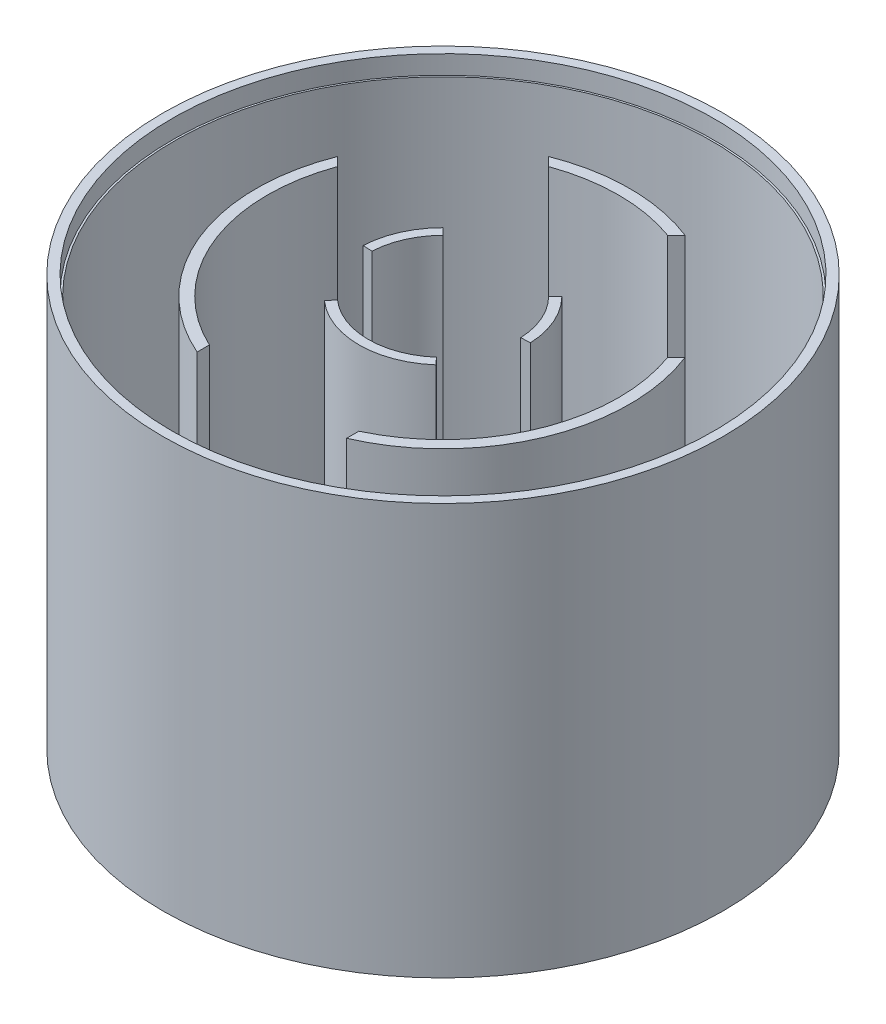
from build123d import *

# Parameters (mm, degrees)
SKETCH1_R           = 75
BOSS_EXTRUDE1_DEPTH = 110
SKETCH2_R           = 72
CUT_EXTRUDE1_DEPTH  = 100
SKETCH3_R           = 72.5
CUT_EXTRUDE2_DEPTH  = 5
SKETCH8_R           = 50
SKETCH8_R_2         = 47
BOSS_EXTRUDE4_DEPTH = 95
SKETCH10_R          = 22.5
SKETCH10_R_2        = 20
BOSS_EXTRUDE5_DEPTH = 95
CUT_EXTRUDE3_START  = -95
SKETCH11_W          = 20
SKETCH11_H          = 27.4
CUT_EXTRUDE3_DEPTH  = 95


with BuildPart() as part:
    # Sketch1 → Boss-Extrude1 (new body)
    with BuildSketch(Plane(origin=(0, 0, 0), x_dir=(1, 0, 0), z_dir=(0, 1, 0))):
        with Locations(Location((0, 0, 0), (0, 0, 90))):
            Circle(SKETCH1_R)
    extrude(amount=BOSS_EXTRUDE1_DEPTH)

    # Sketch2 → Cut-Extrude1 (cut)
    with BuildSketch(Plane(origin=(0, 110, 0), x_dir=(1, 0, 0), z_dir=(0, 1, 0))):
        with Locations(Location((0, 0, 0), (0, 0, 270))):
            Circle(SKETCH2_R)
    extrude(amount=-CUT_EXTRUDE1_DEPTH, mode=Mode.SUBTRACT)

    # Sketch3 → Cut-Extrude2 (cut)
    with BuildSketch(Plane(origin=(0, 110, 0), x_dir=(1, 0, 0), z_dir=(0, 1, 0))):
        with Locations(Location((0, 0, 0), (0, 0, 270))):
            Circle(SKETCH3_R)
    extrude(amount=-CUT_EXTRUDE2_DEPTH, mode=Mode.SUBTRACT)

    # Sketch8 → Boss-Extrude4 (add)
    with BuildSketch(Plane(origin=(0, 10, 0), x_dir=(1, 0, 0), z_dir=(0, 1, 0))):
        with Locations(Location((0, 0, 0), (0, 0, 270))):
            Circle(SKETCH8_R)
        with Locations(Location((0, 0, 0), (0, 0, 270))):
            Circle(SKETCH8_R_2, mode=Mode.SUBTRACT)
    extrude(amount=BOSS_EXTRUDE4_DEPTH)

    # Sketch10 → Boss-Extrude5 (add)
    with BuildSketch(Plane(origin=(0, 10, 0), x_dir=(1, 0, 0), z_dir=(0, 1, 0))):
        with Locations(Location((0, 0, 0), (0, 0, 270))):
            Circle(SKETCH10_R)
        with Locations(Location((0, 0, 0), (0, 0, 270))):
            Circle(SKETCH10_R_2, mode=Mode.SUBTRACT)
    extrude(amount=BOSS_EXTRUDE5_DEPTH)

    # Sketch11 → Cut-Extrude3 (cut)
    with BuildSketch(Plane(origin=(0, 105, 0), x_dir=(1, 0, 0), z_dir=(0, 1, 0)).offset(CUT_EXTRUDE3_START)):
        with Locations((-10, -36.3)):
            Rectangle(SKETCH11_W, SKETCH11_H)
        with Locations((10, -36.3)):
            Rectangle(SKETCH11_W, SKETCH11_H)
        Polygon((-35.352400393, 35.358277481), (-15.986116357, 15.988773936), (-15.984553545, 15.990430632), (-2.254814273, 30.544962608), (-21.21026477, 49.500413105), align=None)
        Polygon((-49.494536017, 21.216141857), (-29.714292817, 1.435898657), (-15.986116357, 15.988773936), (-35.352400393, 35.358277481), align=None)
        Polygon((2.486026551, 30.767534041), (15.99775062, 15.995091549), (35.358277481, 35.352400393), (21.217317324, 49.495711386), align=None)
        Polygon((35.358277481, 35.352400393), (15.99775062, 15.995091549), (29.509474689, 1.222649056), (49.499237638, 21.209089401), align=None)
        with BuildLine():
            ThreePointArc((-13.25433726, -14.977401103), (-18.428729118, -7.770581901), (-19.97668921, 0.96534356))
            Line((-19.97668921, 0.96534356), (-22.473775362, 1.086011505))
            ThreePointArc((-22.473775362, 1.086011505), (-20.732320258, -8.741904639), (-14.911129417, -16.849576241))
            Line((-14.911129417, -16.849576241), (-13.25433726, -14.977401103))
        make_face()
        with BuildLine():
            ThreePointArc((20, 0), (18.235771785, -8.213198366), (13.25433726, -14.977401103))
            Line((13.25433726, -14.977401103), (14.911129417, -16.849576241))
            ThreePointArc((14.911129417, -16.849576241), (20.515243258, -9.239848162), (22.5, 0))
            ThreePointArc((22.5, 0), (22.495177624, 0.46581504), (22.480712564, 0.931430406))
            Line((22.480712564, 0.931430406), (19.982855613, 0.827938139))
            ThreePointArc((19.982855613, 0.827938139), (19.995713444, 0.414057814), (20, 0))
        make_face()
        with BuildLine():
            Line((-15.908580177, 15.911224866), (-14.140960157, 14.143310992))
            ThreePointArc((-14.140960157, 14.143310992), (0.001662291, 19.999999931), (14.143310992, 14.140960157))
            Line((14.143310992, 14.140960157), (15.911224866, 15.908580177))
            ThreePointArc((15.911224866, 15.908580177), (0.001870078, 22.499999922), (-15.908580177, 15.911224866))
        make_face()
    extrude(amount=CUT_EXTRUDE3_DEPTH, mode=Mode.SUBTRACT)


solid = part.part
